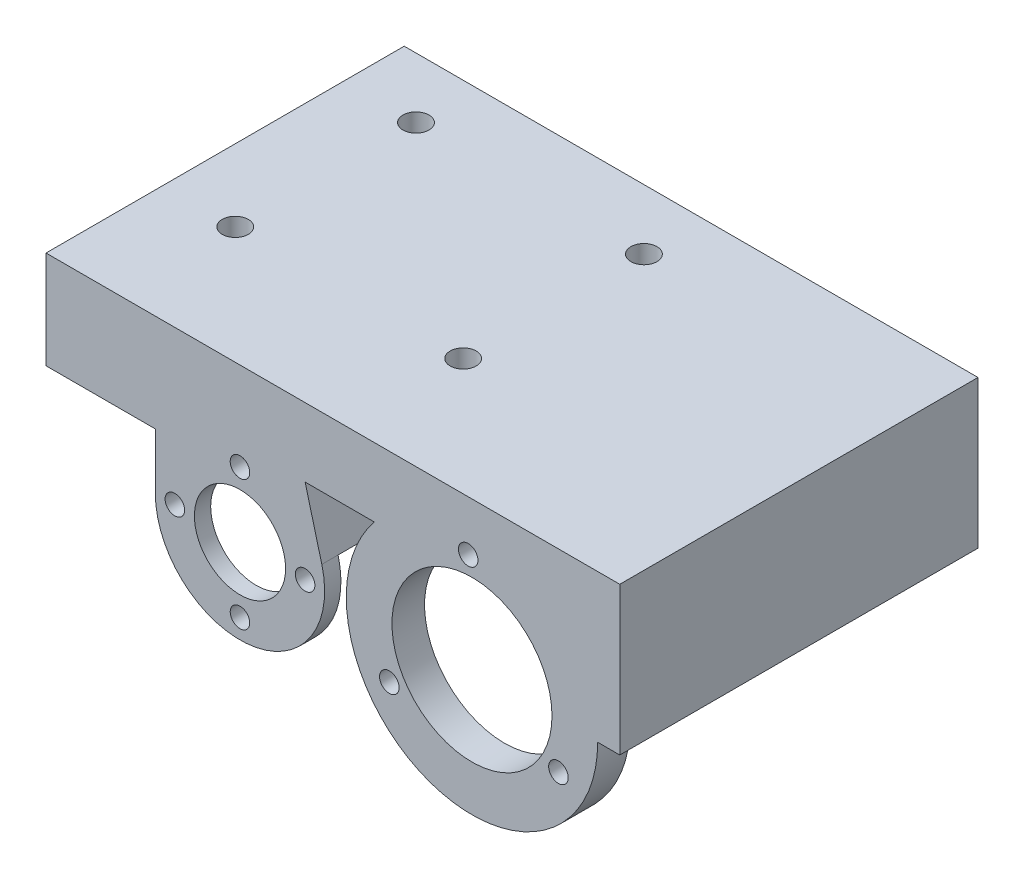
from build123d import *

# Parameters (mm, degrees)
SKETCH1_R           = 1.5
SKETCH1_R_2         = 12.286192875
BOSS_EXTRUDE1_DEPTH = 5
SKETCH1_4_R         = 19.3
SKETCH1_4_R_2       = 1.5
SKETCH1_4_R_3       = 12.286192875
BOSS_EXTRUDE2_DEPTH = 5
SKETCH1_5_R         = 13
SKETCH1_5_R_2       = 1.5
SKETCH1_5_R_3       = 7
BOSS_EXTRUDE3_DEPTH = 2.5
BOSS_EXTRUDE4_DEPTH = 55
SKETCH2_R           = 2
CUT_EXTRUDE1_DEPTH  = 321.699634413
CUT_EXTRUDE2_START  = -7
SKETCH2_3_R         = 2
CUT_EXTRUDE2_DEPTH  = 8


with BuildPart() as part:
    # Sketch1 → Boss-Extrude1 (new body)
    with BuildSketch(Plane.XY):
        with BuildLine():
            Line((-225.050004998, -11.8), (-313.144033158, -11.8))
            Line((-313.144033158, -11.8), (-313.144033158, -26.8))
            Line((-313.144033158, -26.8), (-296.361685959, -26.8))
            Line((-296.361685959, -26.8), (-296.361685959, -35.361873818))
            ThreePointArc((-296.361685959, -35.361873818), (-292.554074115, -26.169485663), (-283.361685959, -22.361873818))
            Line((-283.361685959, -22.361873818), (-262.746762324, -22.361873818))
            ThreePointArc((-262.746762324, -22.361873818), (-254.180514838, -52.695300476), (-228.442241035, -34.500833448))
            Line((-228.442241035, -34.500833448), (-225.050004998, -34.500833448))
            Line((-225.050004998, -34.500833448), (-225.050004998, -11.8))
        make_face()
        with Locations((-234.469948601, -41.489842931)):
            Circle(SKETCH1_R, mode=Mode.SUBTRACT)
        with Locations((-248.325727491, -19.512186292)):
            Circle(SKETCH1_R, mode=Mode.SUBTRACT)
        with Locations((-260.431047012, -42.50047112)):
            Circle(SKETCH1_R, mode=Mode.SUBTRACT)
        with Locations((-247.742241035, -34.500833448)):
            Circle(SKETCH1_R_2, mode=Mode.SUBTRACT)
    extrude(amount=-BOSS_EXTRUDE1_DEPTH)

    # Sketch1<4> → Boss-Extrude2 (add)
    # profile 1 of 3: a face of its own
    with BuildSketch(Plane.XY):
        with Locations((-247.742241035, -34.500833448)):
            Circle(SKETCH1_4_R)
        with Locations((-248.325727491, -19.512186292)):
            Circle(SKETCH1_4_R_2, mode=Mode.SUBTRACT)
        with Locations((-260.431047012, -42.50047112)):
            Circle(SKETCH1_4_R_2, mode=Mode.SUBTRACT)
        with Locations((-234.469948601, -41.489842931)):
            Circle(SKETCH1_4_R_2, mode=Mode.SUBTRACT)
        with Locations((-247.742241035, -34.500833448)):
            Circle(SKETCH1_4_R_3, mode=Mode.SUBTRACT)
    # profile 2 of 3: a face of its own
    with BuildSketch(Plane.XY):
        with BuildLine():
            Line((-225.050004998, -16.8), (-225.050004998, -11.8))
            Line((-225.050004998, -11.8), (-313.144033158, -11.8))
            Line((-313.144033158, -11.8), (-313.144033158, -26.8))
            Line((-313.144033158, -26.8), (-296.361685959, -26.8))
            Line((-296.361685959, -26.8), (-293.144033158, -26.8))
            ThreePointArc((-293.144033158, -26.8), (-288.73270264, -23.523285228), (-283.361685959, -22.361873818))
            Line((-283.361685959, -22.361873818), (-273.361685959, -22.361873818))
            Line((-273.361685959, -22.361873818), (-262.746762324, -22.361873818))
            ThreePointArc((-262.746762324, -22.361873818), (-252.335822317, -15.755460392), (-240.050004998, -16.8))
            Line((-240.050004998, -16.8), (-225.050004998, -16.8))
        make_face()
    # profile 3 of 3: a face of its own
    with BuildSketch(Plane.XY):
        with BuildLine():
            Line((-225.050004998, -34.500833448), (-225.050004998, -16.8))
            Line((-225.050004998, -16.8), (-240.050004998, -16.8))
            ThreePointArc((-240.050004998, -16.8), (-231.603000726, -23.917123217), (-228.442241035, -34.500833448))
            Line((-228.442241035, -34.500833448), (-225.050004998, -34.500833448))
        make_face()
    extrude(amount=-BOSS_EXTRUDE2_DEPTH)

    # Sketch1<5> → Boss-Extrude3 (add)
    with BuildSketch(Plane.XY):
        with Locations((-283.361685959, -35.361873818)):
            Circle(SKETCH1_5_R)
        with Locations((-283.361685959, -25.361873818)):
            Circle(SKETCH1_5_R_2, mode=Mode.SUBTRACT)
        with Locations((-293.361685959, -35.361873818)):
            Circle(SKETCH1_5_R_2, mode=Mode.SUBTRACT)
        with Locations((-283.361685959, -45.361873818)):
            Circle(SKETCH1_5_R_2, mode=Mode.SUBTRACT)
        with Locations((-273.361685959, -35.361873818)):
            Circle(SKETCH1_5_R_2, mode=Mode.SUBTRACT)
        with Locations((-283.361685959, -35.361873818)):
            Circle(SKETCH1_5_R_3, mode=Mode.SUBTRACT)
    extrude(amount=-BOSS_EXTRUDE3_DEPTH)

    # Sketch1<6> → Boss-Extrude4 (add)
    with BuildSketch(Plane.XY):
        with BuildLine():
            Line((-270.796630197, -32.027301328), (-273.361685959, -22.361873818))
            Line((-273.361685959, -22.361873818), (-283.361685959, -22.361873818))
            ThreePointArc((-283.361685959, -22.361873818), (-275.435446068, -25.05776196), (-270.796630197, -32.027301328))
        make_face()
        with BuildLine():
            Line((-225.050004998, -34.500833448), (-225.050004998, -16.8))
            Line((-225.050004998, -16.8), (-240.050004998, -16.8))
            ThreePointArc((-240.050004998, -16.8), (-231.603000726, -23.917123217), (-228.442241035, -34.500833448))
            Line((-228.442241035, -34.500833448), (-225.050004998, -34.500833448))
        make_face()
        with BuildLine():
            Line((-293.144033158, -26.8), (-296.361685959, -26.8))
            Line((-296.361685959, -26.8), (-296.361685959, -35.361873818))
            ThreePointArc((-296.361685959, -35.361873818), (-295.530714548, -30.788609863), (-293.144033158, -26.8))
        make_face()
        with BuildLine():
            Line((-225.050004998, -16.8), (-225.050004998, -11.8))
            Line((-225.050004998, -11.8), (-313.144033158, -11.8))
            Line((-313.144033158, -11.8), (-313.144033158, -26.8))
            Line((-313.144033158, -26.8), (-296.361685959, -26.8))
            Line((-296.361685959, -26.8), (-293.144033158, -26.8))
            ThreePointArc((-293.144033158, -26.8), (-288.73270264, -23.523285228), (-283.361685959, -22.361873818))
            Line((-283.361685959, -22.361873818), (-273.361685959, -22.361873818))
            Line((-273.361685959, -22.361873818), (-262.746762324, -22.361873818))
            ThreePointArc((-262.746762324, -22.361873818), (-252.335822317, -15.755460392), (-240.050004998, -16.8))
            Line((-240.050004998, -16.8), (-225.050004998, -16.8))
        make_face()
    extrude(amount=-BOSS_EXTRUDE4_DEPTH)

    # Sketch2 → Cut-Extrude1 (cut, through all)
    with BuildSketch(Plane(origin=(0, -11.8, 0), x_dir=(1, 0, 0), z_dir=(0, 1, 0))):
        with Locations(Location((-302.09015188, 45.75, 0), (0, 0, 270))):
            Circle(SKETCH2_R)
        with Locations(Location((-302.09015188, 18, 0), (0, 0, 270))):
            Circle(SKETCH2_R)
        with Locations(Location((-267.09015188, 18, 0), (0, 0, 270))):
            Circle(SKETCH2_R)
        with Locations(Location((-267.09015188, 45.75, 0), (0, 0, 270))):
            Circle(SKETCH2_R)
    extrude(amount=-CUT_EXTRUDE1_DEPTH, mode=Mode.SUBTRACT)

    # Sketch2<3> → Cut-Extrude2 (cut)
    # profile 1 of 4: a face of its own
    with BuildSketch(Plane(origin=(0, -11.8, 0), x_dir=(1, 0, 0), z_dir=(0, 1, 0)).offset(CUT_EXTRUDE2_START)):
        Polygon((-300.069425938, 42.25), (-298.048699996, 45.75), (-300.069425938, 49.25), (-304.110877823, 49.25), (-306.131603765, 45.75), (-304.110877823, 42.25), align=None)
        with Locations(Location((-302.09015188, 45.75, 0), (0, 0, 270))):
            Circle(SKETCH2_3_R, mode=Mode.SUBTRACT)
    # profile 2 of 4: a face of its own
    with BuildSketch(Plane(origin=(0, -11.8, 0), x_dir=(1, 0, 0), z_dir=(0, 1, 0)).offset(CUT_EXTRUDE2_START)):
        Polygon((-300.069425938, 14.5), (-298.048699996, 18), (-300.069425938, 21.5), (-304.110877823, 21.5), (-306.131603765, 18), (-304.110877823, 14.5), align=None)
        with Locations(Location((-302.09015188, 18, 0), (0, 0, 270))):
            Circle(SKETCH2_3_R, mode=Mode.SUBTRACT)
    # profile 3 of 4: a face of its own
    with BuildSketch(Plane(origin=(0, -11.8, 0), x_dir=(1, 0, 0), z_dir=(0, 1, 0)).offset(CUT_EXTRUDE2_START)):
        Polygon((-269.110877823, 21.5), (-271.131603765, 18), (-269.110877823, 14.5), (-265.069425938, 14.5), (-263.048699996, 18), (-265.069425938, 21.5), align=None)
        with Locations(Location((-267.09015188, 18, 0), (0, 0, 270))):
            Circle(SKETCH2_3_R, mode=Mode.SUBTRACT)
    # profile 4 of 4: a face of its own
    with BuildSketch(Plane(origin=(0, -11.8, 0), x_dir=(1, 0, 0), z_dir=(0, 1, 0)).offset(CUT_EXTRUDE2_START)):
        Polygon((-269.110877823, 42.25), (-265.069425938, 42.25), (-263.048699996, 45.75), (-265.069425938, 49.25), (-269.110877823, 49.25), (-271.131603765, 45.75), align=None)
        with Locations(Location((-267.09015188, 45.75, 0), (0, 0, 270))):
            Circle(SKETCH2_3_R, mode=Mode.SUBTRACT)
    extrude(amount=-CUT_EXTRUDE2_DEPTH, mode=Mode.SUBTRACT)


solid = part.part
